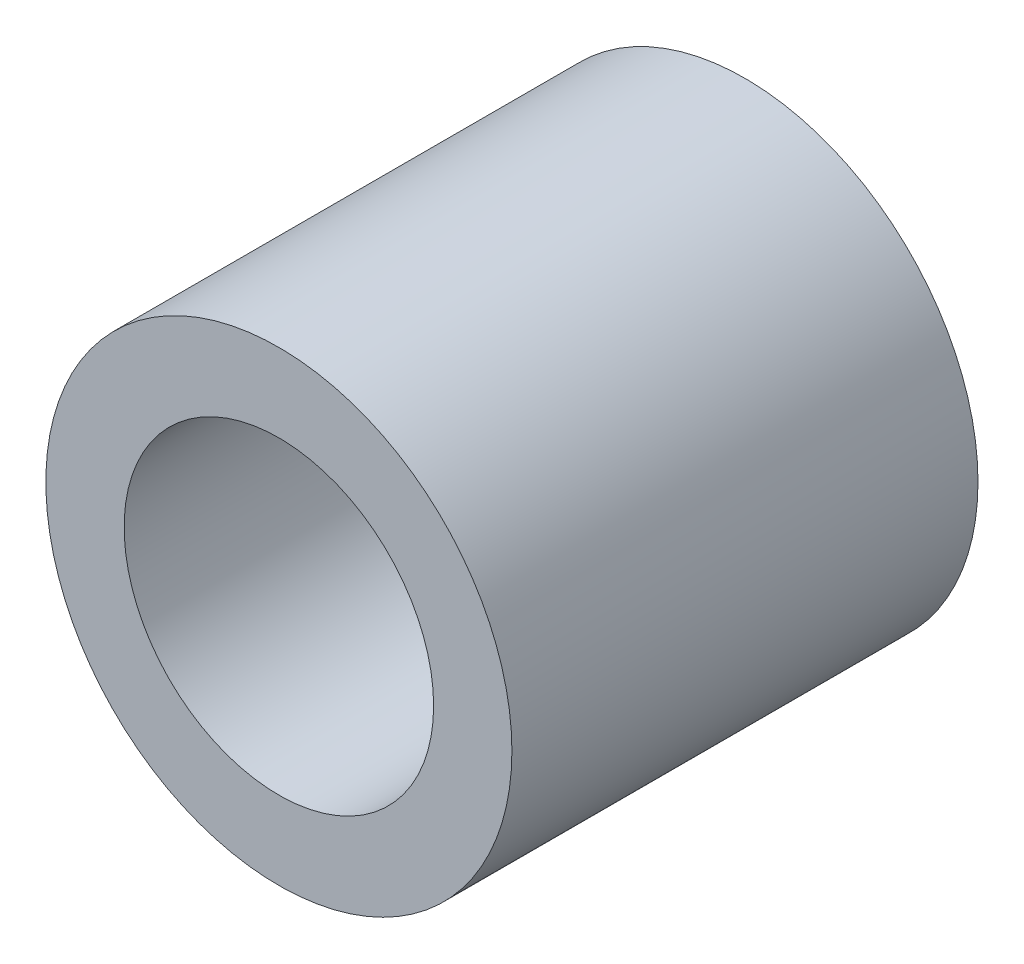
from build123d import *

# Parameters (mm, degrees)
SKETCH1_R      = 3.175
SKETCH1_R_2    = 2.1082
EXTRUDE1_DEPTH = 3.175


with BuildPart() as part:
    # Sketch1 → Extrude1 (new, symmetric)
    with BuildSketch(Plane.XY):
        Circle(SKETCH1_R)
        Circle(SKETCH1_R_2, mode=Mode.SUBTRACT)
    extrude(amount=EXTRUDE1_DEPTH, both=True)


solid = part.part
